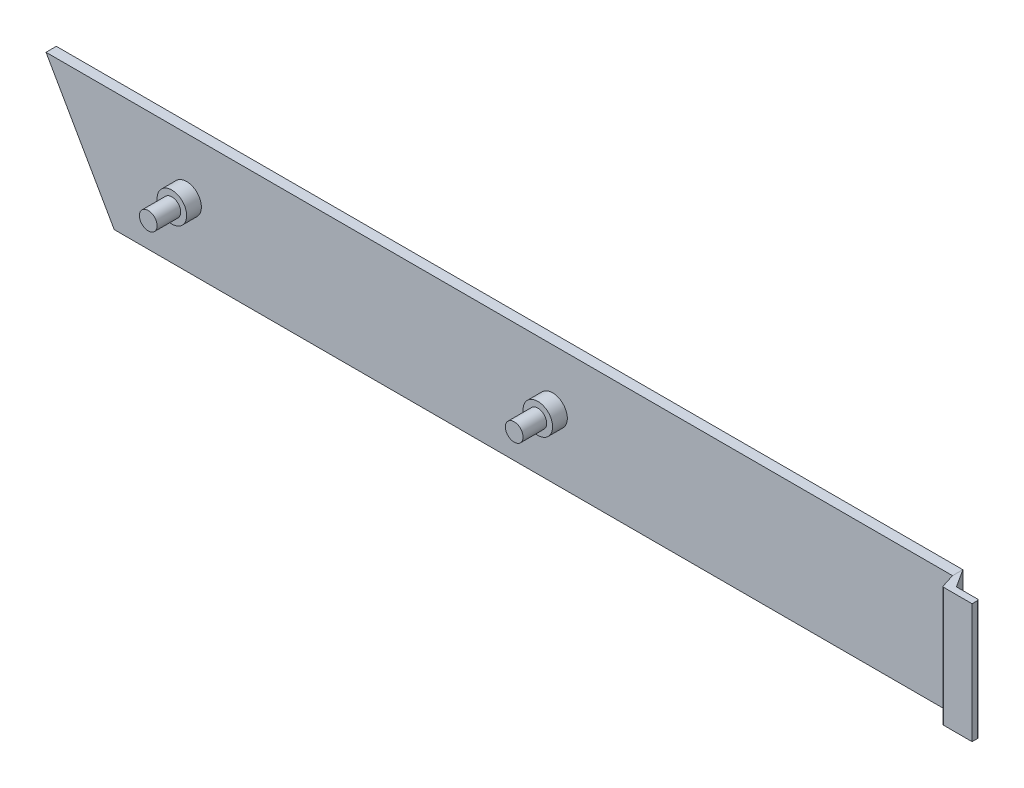
from build123d import *

# Parameters (mm, degrees)
EXTRUDE_1_DEPTH = 3.5
EXTRUDE_2_DEPTH = 40.479556073
FILLET_4_R      = 0.5
SKETCH_4_R      = 5
EXTRUDE_3_DEPTH = 5
SKETCH_5_R      = 3
EXTRUDE_4_DEPTH = 8


with BuildPart() as part:
    # 草图1 → 凸台-拉伸1 (new body)
    with BuildSketch(Plane.XY):
        Polygon((-148.498660968, 0), (135.501339032, 0), (135.501339032, 40.479556073), (-171.618506635, 40.479556073), align=None)
    extrude(amount=EXTRUDE_1_DEPTH)

    # 草图4 → 凸台-拉伸3 (add)
    with BuildSketch(Plane.XY.offset(3.5)):
        with Locations(Location((-123.979089883, 21.38139451, 0), (0, 0, 180))):
            Circle(SKETCH_4_R)
        with Locations(Location((0, 21.38139451, 0), (0, 0, 180))):
            Circle(SKETCH_4_R)
    extrude(amount=EXTRUDE_3_DEPTH)

    # 草图5 → 凸台-拉伸4 (add)
    with BuildSketch(Plane.XY.offset(8.5)):
        with Locations((-123.979089883, 21.38139451)):
            Circle(SKETCH_5_R)
        with Locations((0, 21.38139451)):
            Circle(SKETCH_5_R)
    extrude(amount=EXTRUDE_4_DEPTH)


with BuildPart() as body_2:
    # 草图3 → 凸台-拉伸2 (new body)
    with BuildSketch(Plane(origin=(0, 0, 0), x_dir=(1, 0, 0), z_dir=(0, 1, 0))):
        Polygon((135.501339032, 0), (139.442840957, -6.125927086), (147.04430839, -6.125927086), (147.04430839, -8.428518352), (137.04430839, -8.428518352), (135.501339032, -3.5), align=None)
    extrude(amount=EXTRUDE_2_DEPTH)

    # 圆角4
    fillet_4_edges = [body_2.edges().sort_by_distance(p)[0] for p in [
        (139.442840957, 20.239778036, 6.125927086),
        (147.04430839, 20.239778036, 6.125927086),
        (137.04430839, 20.239778036, 8.428518352),
    ]]
    fillet(fillet_4_edges, radius=FILLET_4_R)


solid = Compound([part.part, body_2.part])
